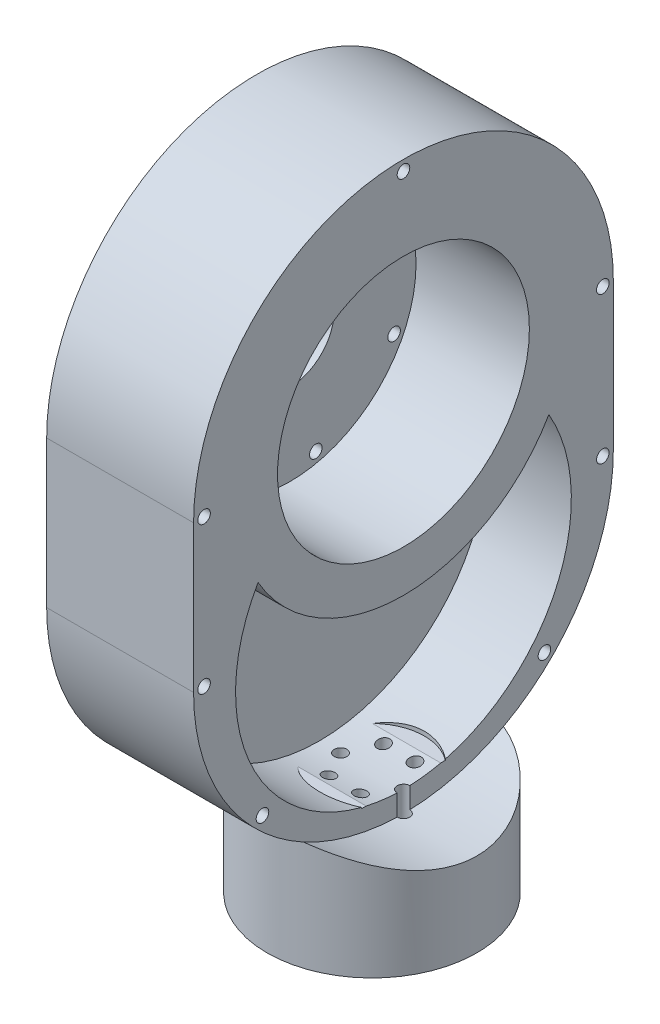
from build123d import *

# Parameters (mm, degrees)
SALIENTE_EXTRUIR3_DEPTH      = 27.5
SALIENTE_EXTRUIR4_REACH      = 167.17
SALIENTE_EXTRUIR4_END_RADIUS = 50
CROQUIS2_R                   = 25
CROQUIS5_R                   = 45
CROQUIS5_R_2                 = 32.5
CORTAR_EXTRUIR2_DEPTH        = 2.5
CROQUIS6_R                   = 10.5
CORTAR_EXTRUIR3_DEPTH        = 172.901134438
CORTAR_EXTRUIR4_DEPTH        = 20
CROQUIS8_R                   = 30
CORTAR_EXTRUIR5_DEPTH        = 27
CROQUIS9_R                   = 1.5
CORTAR_EXTRUIR7_DEPTH        = 30
CROQUIS10_R                  = 12.5
CORTAR_EXTRUIR8_DEPTH        = 5
CROQUIS11_R                  = 1.5
CORTAR_EXTRUIR9_DEPTH        = 172.117649646
CORTAR_EXTRUIR10_DEPTH       = 20
CROQUIS13_R                  = 1.5
CORTAR_EXTRUIR11_DEPTH       = 167.583312541
CROQUIS14_R                  = 17.5
CROQUIS14_R_2                = 10
CORTAR_EXTRUIR12_DEPTH       = 2
CROQUIS15_R                  = 13.5
CROQUIS15_R_2                = 10
CORTAR_EXTRUIR13_DEPTH       = 4


with BuildPart() as part:
    # Croquis3 → Saliente-Extruir3 (new, symmetric)
    with BuildSketch(Plane(origin=(0, 0, 0), x_dir=(0, 0, -1), z_dir=(1, 0, 0))):
        with BuildLine():
            Line((-50, 105), (-50, 70))
            ThreePointArc((-50, 70), (0, 20), (50, 70))
            Line((50, 70), (50, 105))
            ThreePointArc((50, 105), (0, 155), (-50, 105))
        make_face()
    extrude(amount=SALIENTE_EXTRUIR3_DEPTH, both=True)

    # Saliente-Extruir4: up to this cylinder (the profile starts outside it)
    saliente_extruir4_end = Plane(origin=(0, 70, 0), z_dir=(-1, 0, 0)) * Cylinder(SALIENTE_EXTRUIR4_END_RADIUS, 435.34, mode=Mode.PRIVATE)
    # Croquis2 → Saliente-Extruir4 (add, up to the surface)
    with BuildSketch(Plane(origin=(0, 0, 0), x_dir=(1, 0, 0), z_dir=(0, 1, 0)), mode=Mode.PRIVATE) as saliente_extruir4_sk1:
        with Locations(Location((0, 0, 0), (0, 0, 90))):
            Circle(CROQUIS2_R)
    saliente_extruir4_tool1 = extrude(saliente_extruir4_sk1.sketch, amount=SALIENTE_EXTRUIR4_REACH, mode=Mode.PRIVATE) - saliente_extruir4_end
    add(saliente_extruir4_tool1.solids().sort_by_distance((0, 0, 0))[0])

    # Croquis5 → Cortar-Extruir2 (cut)
    with BuildSketch(Plane.ZY.offset(27.5)):
        with Locations((0, 105)):
            Circle(CROQUIS5_R)
        with Locations((0, 105)):
            Circle(CROQUIS5_R_2, mode=Mode.SUBTRACT)
    extrude(amount=-CORTAR_EXTRUIR2_DEPTH, mode=Mode.SUBTRACT)

    # Croquis6 → Cortar-Extruir3 (cut, through all)
    with BuildSketch(Plane.ZY.offset(27.5)):
        with Locations((0, 105)):
            Circle(CROQUIS6_R)
    extrude(amount=-CORTAR_EXTRUIR3_DEPTH, mode=Mode.SUBTRACT)

    # Croquis7 → Cortar-Extruir4 (cut)
    with BuildSketch(Plane(origin=(27.5, 0, 0), x_dir=(0, 0, -1), z_dir=(1, 0, 0))):
        with BuildLine():
            Line((-50, 105), (-50, 70))
            ThreePointArc((-50, 70), (0, 20), (50, 70))
            Line((50, 70), (50, 105))
            ThreePointArc((50, 105), (0, 155), (-50, 105))
        make_face()
    extrude(amount=-CORTAR_EXTRUIR4_DEPTH, mode=Mode.SUBTRACT)

    # Croquis8 → Cortar-Extruir5 (cut)
    with BuildSketch(Plane(origin=(7.5, 0, 0), x_dir=(0, 0, -1), z_dir=(1, 0, 0))):
        with Locations((0, 105)):
            Circle(CROQUIS8_R)
    extrude(amount=-CORTAR_EXTRUIR5_DEPTH, mode=Mode.SUBTRACT)

    # Croquis9 → Cortar-Extruir7 (cut)
    with BuildSketch(Plane.XZ):
        with Locations(Location((7.5, 0, 0), (0, 0, 270))):
            Circle(CROQUIS9_R)
        with Locations(Location((3.75, -6.495190528, 0), (0, 0, 270))):
            Circle(CROQUIS9_R)
        with Locations(Location((-3.75, -6.495190528, 0), (0, 0, 270))):
            Circle(CROQUIS9_R)
        with Locations(Location((-7.5, 0, 0), (0, 0, 270))):
            Circle(CROQUIS9_R)
        with Locations(Location((-3.75, 6.495190528, 0), (0, 0, 270))):
            Circle(CROQUIS9_R)
        with Locations(Location((3.75, 6.495190528, 0), (0, 0, 270))):
            Circle(CROQUIS9_R)
    extrude(amount=-CORTAR_EXTRUIR7_DEPTH, mode=Mode.SUBTRACT)

    # Croquis10 → Cortar-Extruir8 (cut)
    with BuildSketch(Plane(origin=(0, 26, 0), x_dir=(1, 0, 0), z_dir=(0, 1, 0))):
        Circle(CROQUIS10_R)
    extrude(amount=CORTAR_EXTRUIR8_DEPTH, mode=Mode.SUBTRACT)

    # Croquis11 → Cortar-Extruir9 (cut, through all)
    with BuildSketch(Plane.ZY.offset(27.5)):
        with Locations((27.5, 105)):
            Circle(CROQUIS11_R)
        with Locations((17.145969551, 83.499634232)):
            Circle(CROQUIS11_R)
        with Locations((-6.119325684, 78.189482415)):
            Circle(CROQUIS11_R)
        with Locations((-24.776643867, 93.068197174)):
            Circle(CROQUIS11_R)
        with Locations((-24.776643867, 116.931802826)):
            Circle(CROQUIS11_R)
        with Locations((-6.119325684, 131.810517585)):
            Circle(CROQUIS11_R)
        with Locations((17.145969551, 126.500365768)):
            Circle(CROQUIS11_R)
    extrude(amount=-CORTAR_EXTRUIR9_DEPTH, mode=Mode.SUBTRACT)

    # Croquis12 → Cortar-Extruir10 (cut)
    with BuildSketch(Plane(origin=(7.5, 0, 0), x_dir=(0, 0, -1), z_dir=(1, 0, 0))):
        with BuildLine():
            ThreePointArc((-34.641016151, 85), (0, 25), (34.641016151, 85))
            ThreePointArc((34.641016151, 85), (0, 65), (-34.641016151, 85))
        make_face()
    extrude(amount=-CORTAR_EXTRUIR10_DEPTH, mode=Mode.SUBTRACT)

    # Croquis13 → Cortar-Extruir11 (cut, through all)
    with BuildSketch(Plane(origin=(7.5, 0, 0), x_dir=(0, 0, -1), z_dir=(1, 0, 0))):
        with Locations((0, 152.5)):
            Circle(CROQUIS13_R)
        with Locations((47.5, 105)):
            Circle(CROQUIS13_R)
        with Locations((-47.5, 105)):
            Circle(CROQUIS13_R)
        with Locations((-47.5, 70)):
            Circle(CROQUIS13_R)
        with Locations((47.5, 70)):
            Circle(CROQUIS13_R)
        with Locations((33.587572106, 36.412427894)):
            Circle(CROQUIS13_R)
        with Locations((-33.587572106, 36.412427894)):
            Circle(CROQUIS13_R)
    extrude(amount=-CORTAR_EXTRUIR11_DEPTH, mode=Mode.SUBTRACT)

    # Croquis14 → Cortar-Extruir12 (cut)
    with BuildSketch(Plane.XZ):
        with Locations(Location((0, 0, 0), (0, 0, 270))):
            Circle(CROQUIS14_R)
        with Locations(Location((0, 0, 0), (0, 0, 270))):
            Circle(CROQUIS14_R_2, mode=Mode.SUBTRACT)
    extrude(amount=-CORTAR_EXTRUIR12_DEPTH, mode=Mode.SUBTRACT)

    # Croquis15 → Cortar-Extruir13 (cut)
    with BuildSketch(Plane.ZY.offset(27.5)):
        with Locations((0, 105)):
            Circle(CROQUIS15_R)
        with Locations((0, 105)):
            Circle(CROQUIS15_R_2, mode=Mode.SUBTRACT)
    extrude(amount=-CORTAR_EXTRUIR13_DEPTH, mode=Mode.SUBTRACT)


solid = part.part
